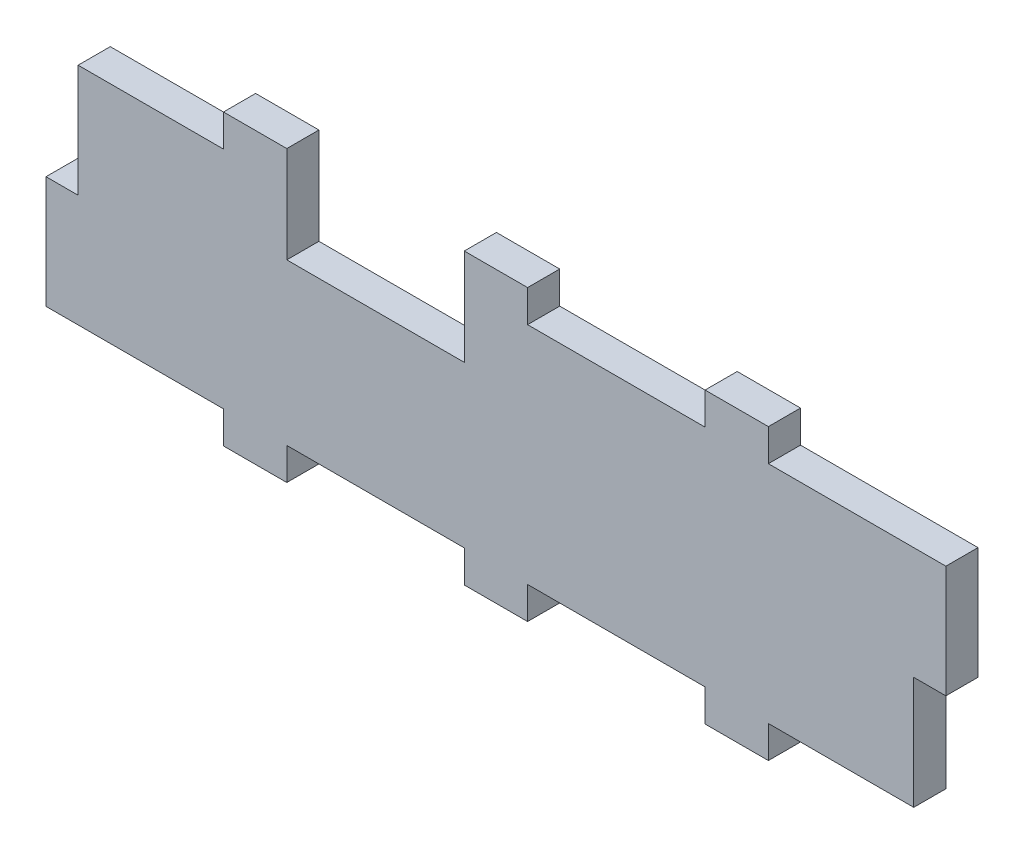
from build123d import *

# Parameters (mm, degrees)
SKETCH2_W           = 130
SKETCH2_H           = 35
SKETCH2_W_2         = 5
SKETCH2_H_2         = 17.475
SKETCH2_W_3         = 9.85
SKETCH2_H_3         = 5
BOSS_EXTRUDE1_DEPTH = 5
SKETCH3_W           = 27.6125
SKETCH3_H           = 10
CUT_EXTRUDE1_DEPTH  = 74.697014865


with BuildPart() as part:
    # Sketch2 → Boss-Extrude1 (new body)
    with BuildSketch(Plane.XY):
        Rectangle(SKETCH2_W, SKETCH2_H)
        with Locations((-67.5, -8.7625)):
            Rectangle(SKETCH2_W_2, SKETCH2_H_2)
        with Locations((-37.4625, 20)):
            Rectangle(SKETCH2_W_3, SKETCH2_H_3)
        with Locations((0, 20)):
            Rectangle(SKETCH2_W_3, SKETCH2_H_3)
        with Locations((37.4625, 20)):
            Rectangle(SKETCH2_W_3, SKETCH2_H_3)
        with Locations((67.5, 8.7625)):
            Rectangle(SKETCH2_W_2, SKETCH2_H_2)
        with Locations((37.4625, -20)):
            Rectangle(SKETCH2_W_3, SKETCH2_H_3)
        with Locations((0, -20)):
            Rectangle(SKETCH2_W_3, SKETCH2_H_3)
        with Locations((-37.4625, -20)):
            Rectangle(SKETCH2_W_3, SKETCH2_H_3)
    extrude(amount=BOSS_EXTRUDE1_DEPTH)

    # Sketch3 → Cut-Extrude1 (cut, through all)
    with BuildSketch(Plane(origin=(0, 0, 0), x_dir=(-1, 0, 0), z_dir=(0, 0, -1))):
        with Locations((18.73125, 12.5)):
            Rectangle(SKETCH3_W, SKETCH3_H)
    extrude(amount=-CUT_EXTRUDE1_DEPTH, mode=Mode.SUBTRACT)


solid = part.part
